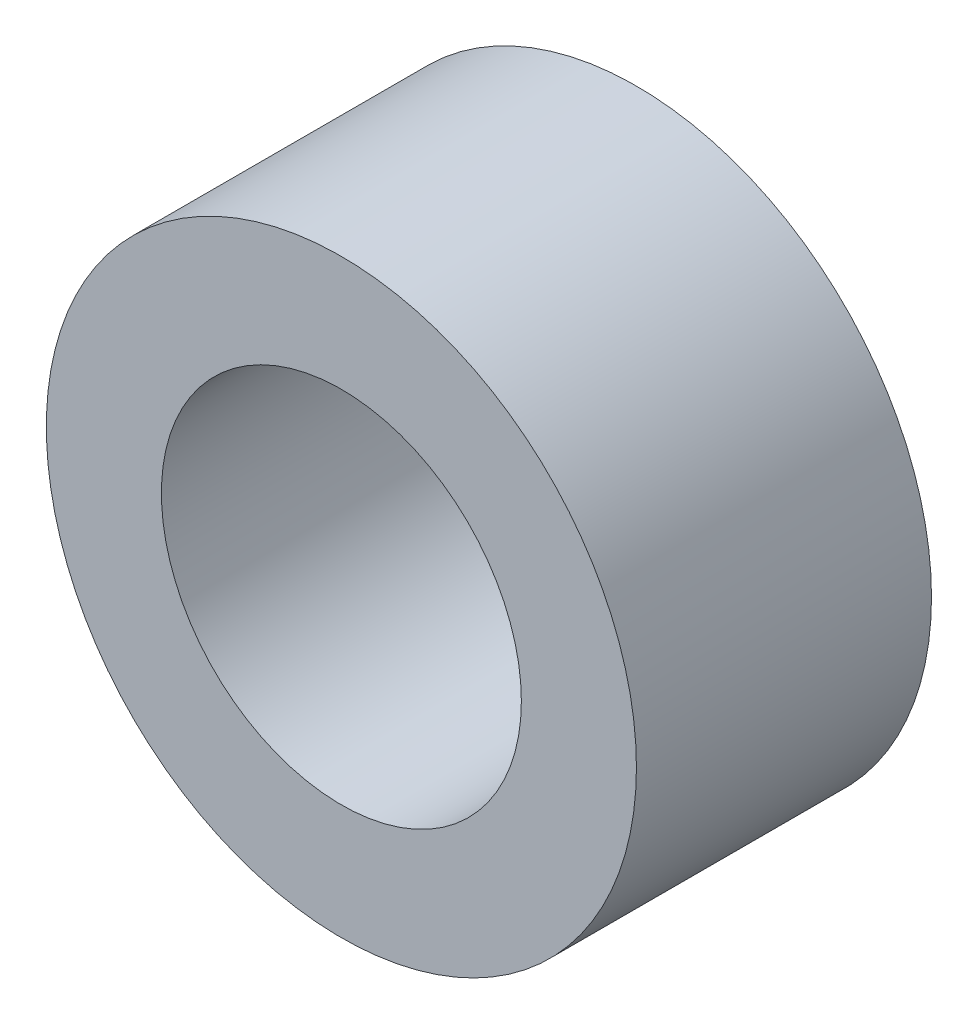
from build123d import *

# Parameters (mm, degrees)
SKETCH1_R           = 5
SKETCH1_R_2         = 3.05
BOSS_EXTRUDE1_DEPTH = 5


with BuildPart() as part:
    # Sketch1 → Boss-Extrude1 (new body)
    with BuildSketch(Plane.XY):
        Circle(SKETCH1_R)
        Circle(SKETCH1_R_2, mode=Mode.SUBTRACT)
    extrude(amount=BOSS_EXTRUDE1_DEPTH)


solid = part.part
